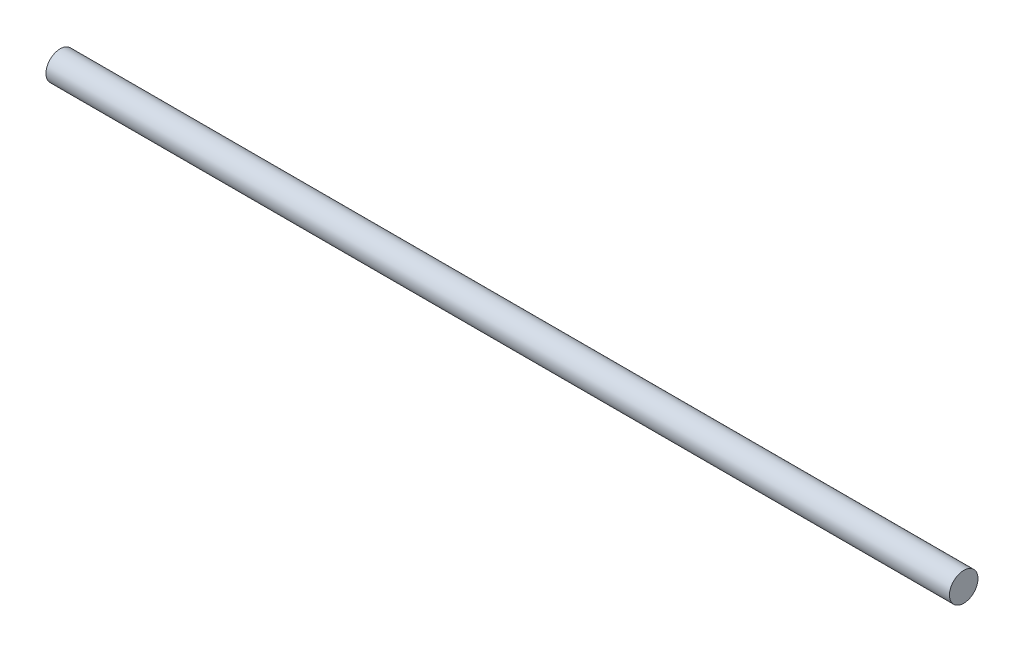
from build123d import *

# Parameters (mm, degrees)
SKETCH1_R           = 1.5
BOSS_EXTRUDE1_DEPTH = 95


with BuildPart() as part:
    # Sketch1 → Boss-Extrude1 (new body)
    with BuildSketch(Plane(origin=(0, 0, 0), x_dir=(0, 0, -1), z_dir=(1, 0, 0))):
        Circle(SKETCH1_R)
    extrude(amount=BOSS_EXTRUDE1_DEPTH)


solid = part.part
